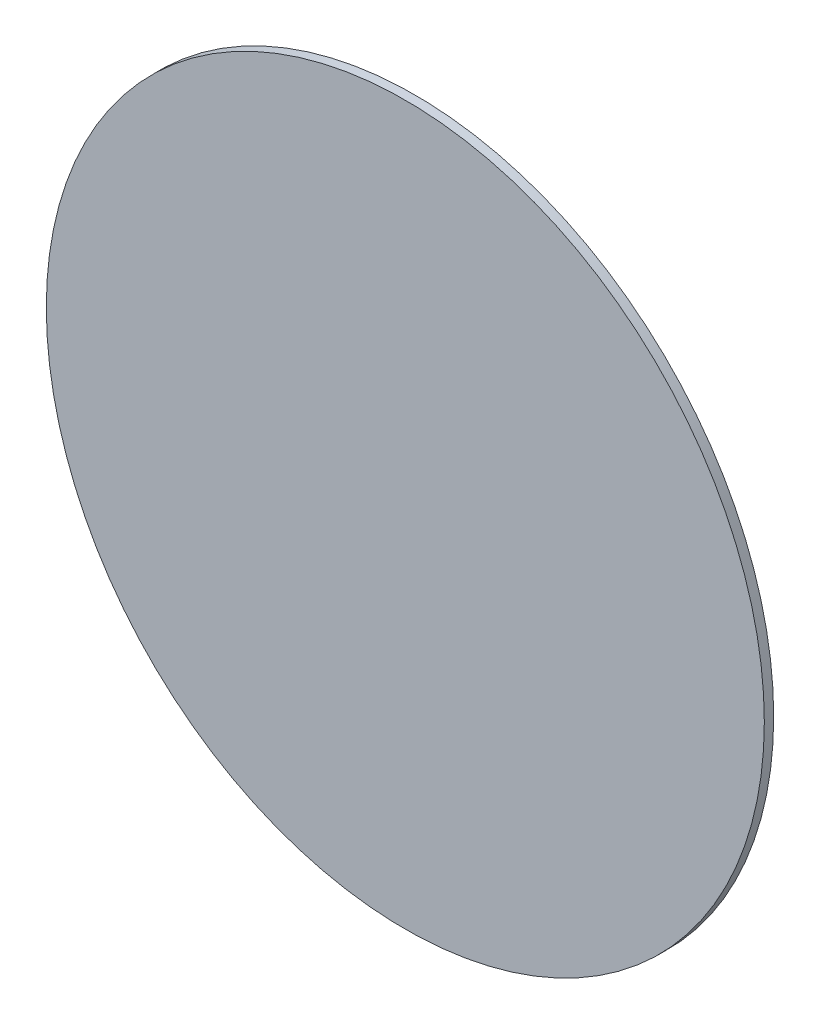
from build123d import *

# Parameters (mm, degrees)
ESQUISSE1_R        = 383.2
BOSS_EXTRU_1_DEPTH = 10


with BuildPart() as part:
    # Esquisse1 → Boss.-Extru.1 (new body)
    with BuildSketch(Plane.XY):
        Circle(ESQUISSE1_R)
    extrude(amount=BOSS_EXTRU_1_DEPTH)


solid = part.part
